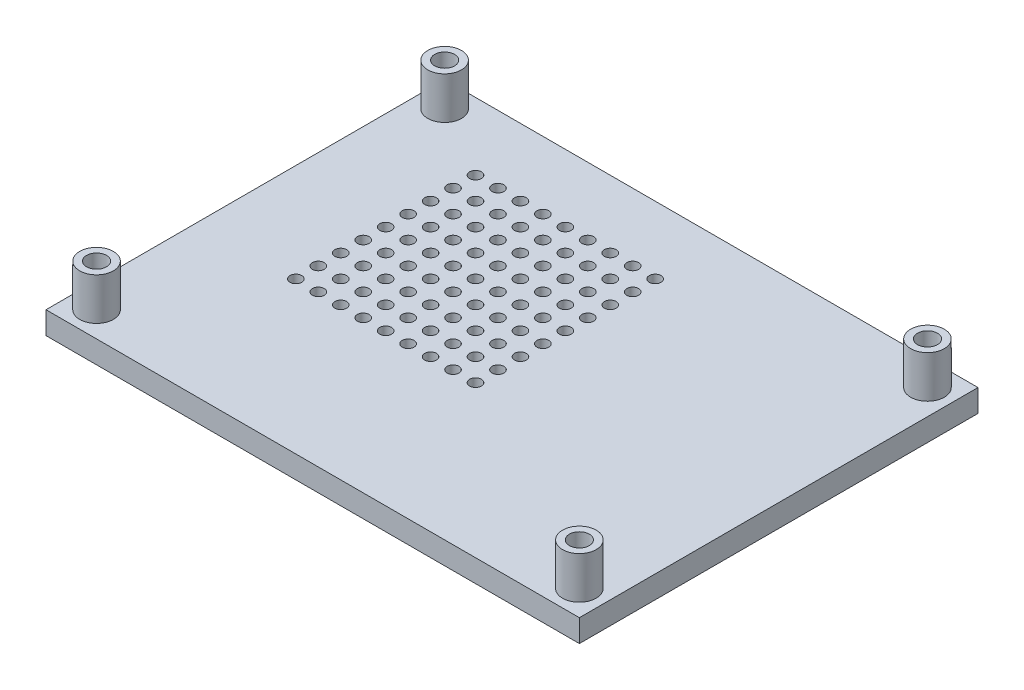
from build123d import *

# Parameters (mm, degrees)
SKETCH1_W            = 95
SKETCH1_H            = 71
BOSS_EXTRUDE1_DEPTH  = 4
SKETCH2_R            = 3
BOSS_EXTRUDE2_DEPTH  = 7.5
SKETCH3_R            = 1.775
CUT_EXTRUDE1_DEPTH   = 64.736204248
SKETCH4_R            = 1.05
CUT_EXTRUDE2_DEPTH   = 64.13718185
LPATTERN1_COUNT      = 9
LPATTERN1_PITCH      = 4
LPATTERN1_COUNT_DIR2 = 9
LPATTERN1_PITCH_DIR2 = 4


with BuildPart() as part:
    # Sketch1 → Boss-Extrude1 (new body)
    with BuildSketch(Plane(origin=(0, 0, 0), x_dir=(1, 0, 0), z_dir=(0, 1, 0))):
        with Locations((4.168563349, 0.002299833)):
            Rectangle(SKETCH1_W, SKETCH1_H)
    extrude(amount=BOSS_EXTRUDE1_DEPTH)

    # Sketch2 → Boss-Extrude2 (add)
    with BuildSketch(Plane(origin=(0, 4, 0), x_dir=(1, 0, 0), z_dir=(0, 1, 0))):
        with Locations(Location((-38.831436651, -30.997700167, 0), (0, 0, 90))):
            Circle(SKETCH2_R)
        with Locations(Location((-38.831436651, 31.002299833, 0), (0, 0, 90))):
            Circle(SKETCH2_R)
        with Locations(Location((47.168563349, 31.002299833, 0), (0, 0, 90))):
            Circle(SKETCH2_R)
        with Locations(Location((47.168563349, -30.997700167, 0), (0, 0, 90))):
            Circle(SKETCH2_R)
    extrude(amount=BOSS_EXTRUDE2_DEPTH)

    # Sketch3 → Cut-Extrude1 (cut, through all)
    with BuildSketch(Plane(origin=(0, 11.5, 0), x_dir=(1, 0, 0), z_dir=(0, 1, 0))):
        with Locations(Location((-38.831436651, 31.002299833, 0), (0, 0, 270))):
            Circle(SKETCH3_R)
        with Locations(Location((-38.831436651, -30.997700167, 0), (0, 0, 270))):
            Circle(SKETCH3_R)
        with Locations(Location((47.168563349, -30.997700167, 0), (0, 0, 270))):
            Circle(SKETCH3_R)
        with Locations(Location((47.168563349, 31.002299833, 0), (0, 0, 270))):
            Circle(SKETCH3_R)
    extrude(amount=-CUT_EXTRUDE1_DEPTH, mode=Mode.SUBTRACT)

    # Sketch4 → Cut-Extrude2 (cut, through all)
    with BuildSketch(Plane(origin=(0, 4, 0), x_dir=(1, 0, 0), z_dir=(0, 1, 0))):
        with Locations(Location((-25.831436651, 23.502299833, 0), (0, 0, 270))):
            Circle(SKETCH4_R)
    cut_extrude2 = extrude(amount=-CUT_EXTRUDE2_DEPTH, mode=Mode.SUBTRACT)

    # LPattern1: Cut-Extrude2 9 × 9
    with Locations(*[(i * LPATTERN1_PITCH, 0, j * LPATTERN1_PITCH_DIR2) for i in range(LPATTERN1_COUNT) for j in range(LPATTERN1_COUNT_DIR2) if (i, j) != (0, 0)]):
        add(cut_extrude2, mode=Mode.SUBTRACT)


solid = part.part
